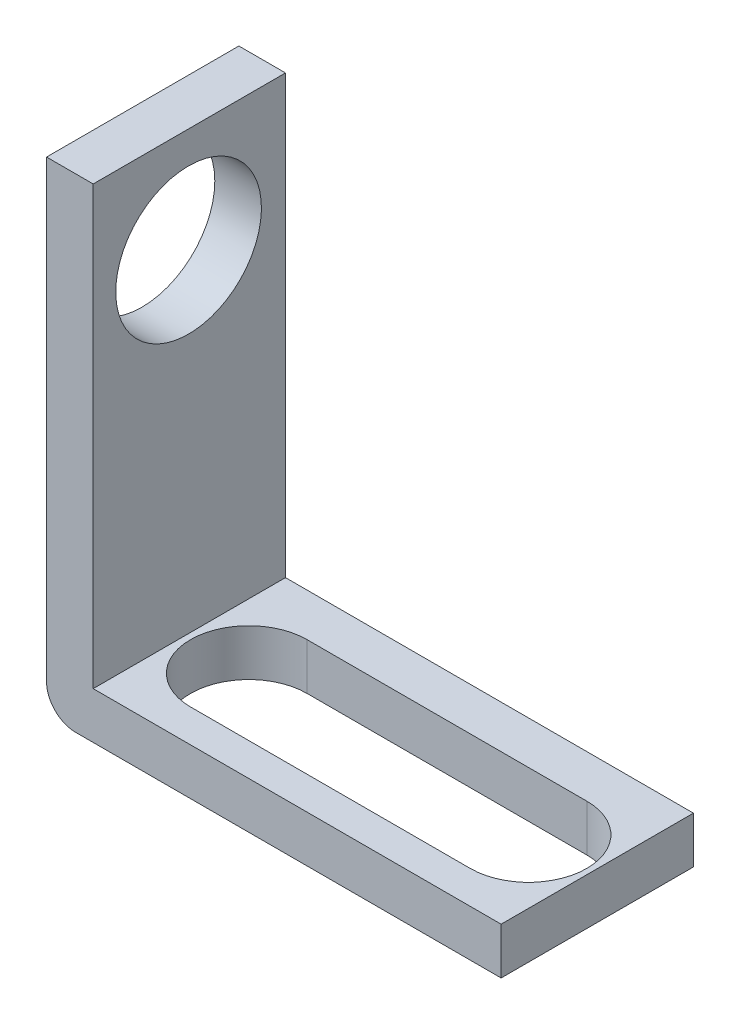
from build123d import *

# Parameters (mm, degrees)
BOSS_EXTRUDE1_DEPTH = 33
SKETCH2_R           = 12.5
CUT_EXTRUDE2_DEPTH  = 33
CUT_EXTRUDE10_DEPTH = 33


with BuildPart() as part:
    # Sketch1 → Boss-Extrude1 (new body)
    with BuildSketch(Plane.XY):
        with BuildLine():
            Line((0, 0), (0, 75))
            Line((0, 75), (8, 75))
            Line((8, 75), (8, 0))
            Line((8, 0), (78, 0))
            Line((78, 0), (78, -8))
            Line((78, -8), (5, -8))
            ThreePointArc((5, -8), (1.464466094, -6.535533906), (0, -3))
            Line((0, -3), (0, 0))
        make_face()
    extrude(amount=BOSS_EXTRUDE1_DEPTH)

    # Sketch2 → Cut-Extrude2 (cut)
    with BuildSketch(Plane(origin=(8, 0, 0), x_dir=(0, 0, -1), z_dir=(1, 0, 0))):
        with Locations(Location((-16.629694818, 57, 0), (0, 0, 90))):
            Circle(SKETCH2_R)
    extrude(amount=-CUT_EXTRUDE2_DEPTH, mode=Mode.SUBTRACT)

    # Sketch3 → Cut-Extrude10 (cut)
    with BuildSketch(Plane(origin=(0, 0, 0), x_dir=(1, 0, 0), z_dir=(0, 1, 0))):
        with BuildLine():
            Line((19.067260463, -7.366474126), (67.067260463, -7.366474126))
            ThreePointArc((67.067260463, -7.366474126), (77.067260463, -17.366474126), (67.067260463, -27.366474126))
            Line((67.067260463, -27.366474126), (19.067259653, -27.366474126))
            ThreePointArc((19.067259653, -27.366474126), (9.067259653, -17.366473721), (19.067260463, -7.366474126))
        make_face()
    extrude(amount=-CUT_EXTRUDE10_DEPTH, mode=Mode.SUBTRACT)


solid = part.part
